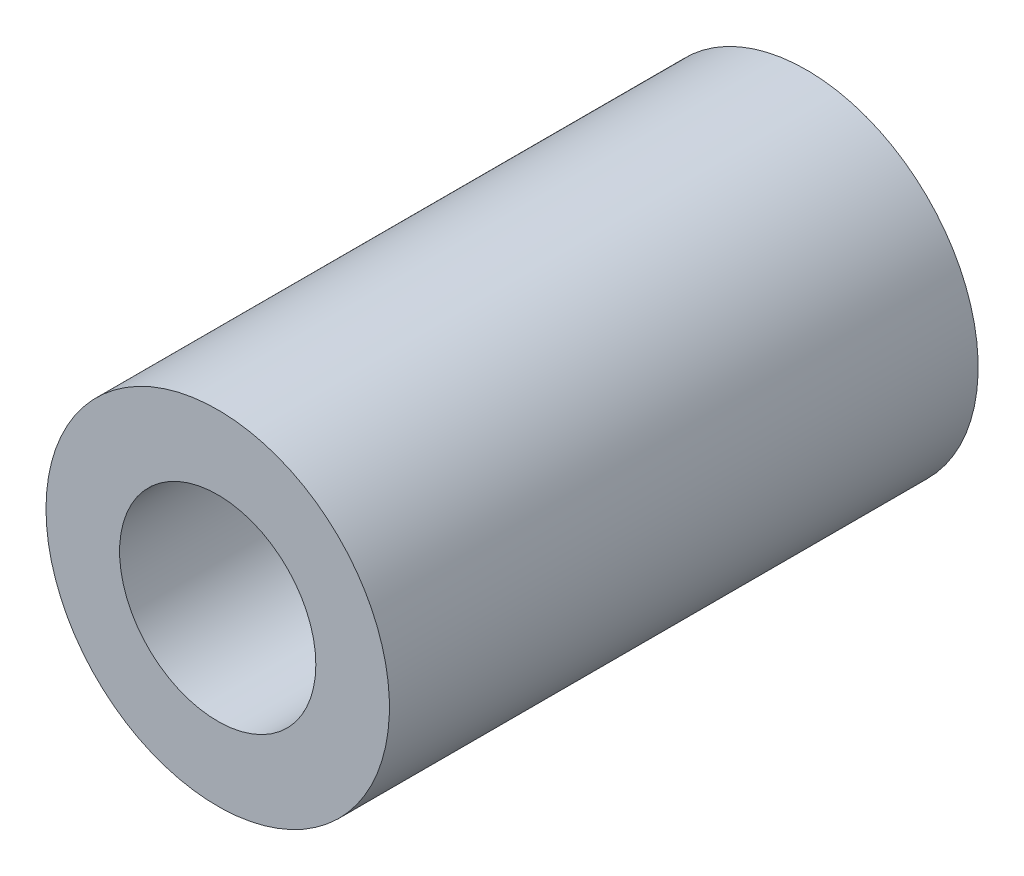
from build123d import *

# Parameters (mm, degrees)
SKETCH1_R                      = 11.1125
BOSS_EXTRUDE1_DEPTH            = 19.05
F_1_2_0_5_DIAMETER_HOLE1_D     = 12.7
F_1_2_0_5_DIAMETER_HOLE1_DEPTH = 22.352
F_1_2_0_5_DIAMETER_HOLE1_TIP   = 3.815464931
SKETCH10_R                     = 3.2639
CUT_EXTRUDE3_DEPTH             = 42.21389708


with BuildPart() as part:
    # Sketch1 → Boss-Extrude1 (new, symmetric)
    with BuildSketch(Plane.XY):
        with Locations(Location((0, 0, 0), (0, 0, 180))):
            Circle(SKETCH1_R)
    extrude(amount=BOSS_EXTRUDE1_DEPTH, both=True)

    # 1/2 (0.5) Diameter Hole1
    with Locations(Plane.XY.offset(19.05)):
        with Locations((0, 0)):
            Hole(F_1_2_0_5_DIAMETER_HOLE1_D / 2, depth=F_1_2_0_5_DIAMETER_HOLE1_DEPTH)
            with Locations((0, 0, -(F_1_2_0_5_DIAMETER_HOLE1_DEPTH + F_1_2_0_5_DIAMETER_HOLE1_TIP / 2))):  # 118° drill point
                Cone(0, F_1_2_0_5_DIAMETER_HOLE1_D / 2, F_1_2_0_5_DIAMETER_HOLE1_TIP, mode=Mode.SUBTRACT)

    # Sketch10 → Cut-Extrude3 (cut, through all)
    with BuildSketch(Plane.XY.offset(19.05)):
        Circle(SKETCH10_R)
    extrude(amount=-CUT_EXTRUDE3_DEPTH, mode=Mode.SUBTRACT)


solid = part.part
